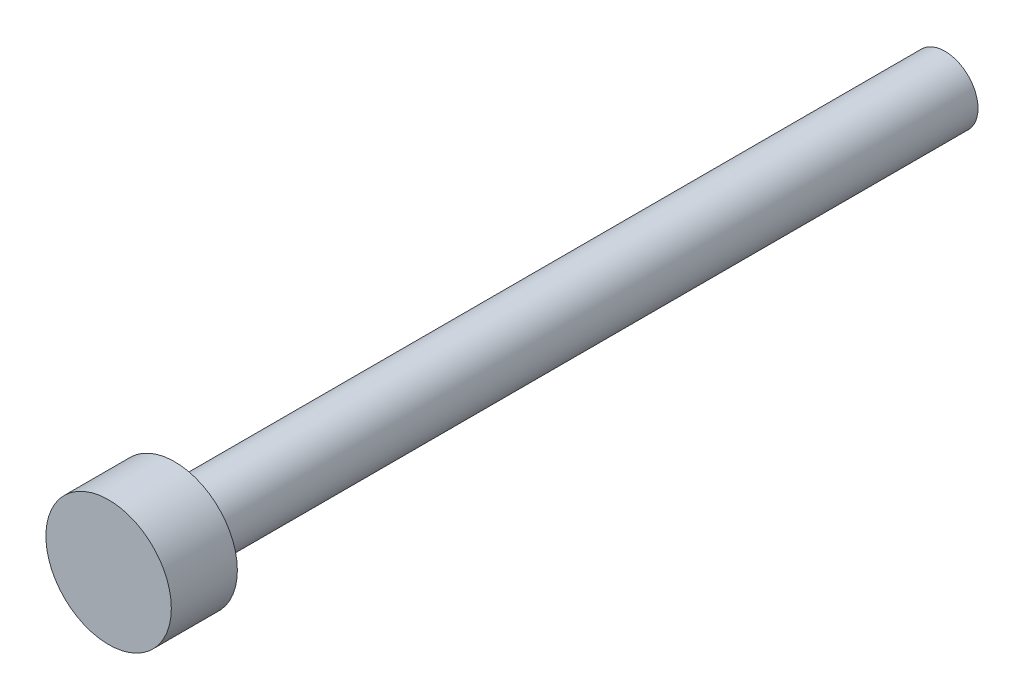
from build123d import *

# Parameters (mm, degrees)
SKETCH1_R           = 1.5
BOSS_EXTRUDE1_DEPTH = 35
SKETCH2_R           = 2.85
BOSS_EXTRUDE2_DEPTH = 3


with BuildPart() as part:
    # Sketch1 → Boss-Extrude1 (new body)
    with BuildSketch(Plane.XY):
        Circle(SKETCH1_R)
    extrude(amount=BOSS_EXTRUDE1_DEPTH)

    # Sketch2 → Boss-Extrude2 (add)
    with BuildSketch(Plane.XY.offset(35)):
        Circle(SKETCH2_R)
    extrude(amount=BOSS_EXTRUDE2_DEPTH)


solid = part.part
